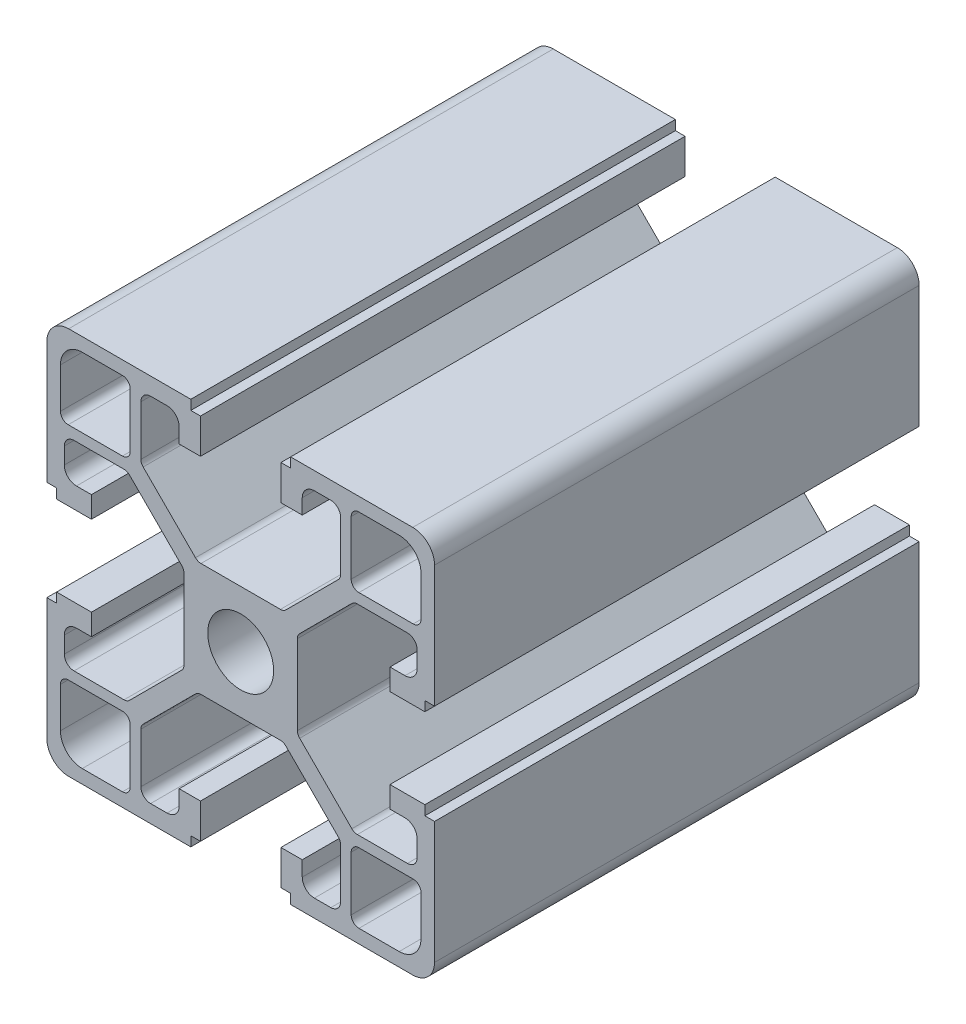
from build123d import *

# Parameters (mm, degrees)
SKETCH1_R           = 3.4
BOSS_EXTRUDE1_DEPTH = 713
SKETCH2_W           = 40
SKETCH2_H           = 113
CUT_EXTRUDE1_DEPTH  = 715.401147815
SKETCH3_W           = 40
SKETCH3_H           = 550
CUT_EXTRUDE2_DEPTH  = 602.66435826


with BuildPart() as part:
    # Sketch1 → Boss-Extrude1 (new body)
    with BuildSketch(Plane.XY):
        with BuildLine():
            Line((20, 17.75), (20, 5.15))
            Line((20, 5.15), (19, 5.15))
            Line((19, 5.15), (19, 4.15))
            Line((19, 4.15), (15.4, 4.15))
            Line((15.4, 4.15), (15.4, 6.35))
            Line((15.4, 6.35), (16.95, 6.35))
            ThreePointArc((16.95, 6.35), (17.833883476, 6.716116524), (18.2, 7.6))
            Line((18.2, 7.6), (18.2, 9.3))
            ThreePointArc((18.2, 9.3), (17.907106781, 10.007106781), (17.2, 10.3))
            Line((17.2, 10.3), (12.03669957, 10.3))
            ThreePointArc((12.03669957, 10.3), (11.73040037, 10.239040459), (11.470780817, 10.065452001))
            Line((11.470780817, 10.065452001), (6.084081247, 4.674305984))
            ThreePointArc((6.084081247, 4.674305984), (5.910833239, 4.414848262), (5.85, 4.108853983))
            Line((5.85, 4.108853983), (5.85, -4.108853983))
            ThreePointArc((5.85, -4.108853983), (5.910833239, -4.414848262), (6.084081247, -4.674305984))
            Line((6.084081247, -4.674305984), (11.470780817, -10.065452001))
            ThreePointArc((11.470780817, -10.065452001), (11.73040037, -10.239040459), (12.03669957, -10.3))
            Line((12.03669957, -10.3), (17.2, -10.3))
            ThreePointArc((17.2, -10.3), (17.907106781, -10.007106781), (18.2, -9.3))
            Line((18.2, -9.3), (18.2, -7.6))
            ThreePointArc((18.2, -7.6), (17.833883476, -6.716116524), (16.95, -6.35))
            Line((16.95, -6.35), (15.4, -6.35))
            Line((15.4, -6.35), (15.4, -4.15))
            Line((15.4, -4.15), (19, -4.15))
            Line((19, -4.15), (19, -5.15))
            Line((19, -5.15), (20, -5.15))
            Line((20, -5.15), (20, -17.75))
            ThreePointArc((20, -17.75), (19.340990258, -19.340990258), (17.75, -20))
            Line((17.75, -20), (5.15, -20))
            Line((5.15, -20), (5.15, -19))
            Line((5.15, -19), (4.15, -19))
            Line((4.15, -19), (4.15, -15.4))
            Line((4.15, -15.4), (6.35, -15.4))
            Line((6.35, -15.4), (6.35, -16.95))
            ThreePointArc((6.35, -16.95), (6.716116524, -17.833883476), (7.6, -18.2))
            Line((7.6, -18.2), (9.3, -18.2))
            ThreePointArc((9.3, -18.2), (10.007106781, -17.907106781), (10.3, -17.2))
            Line((10.3, -17.2), (10.3, -12.054477022))
            ThreePointArc((10.3, -12.054477022), (10.239166761, -11.748482743), (10.065918753, -11.489025021))
            Line((10.065918753, -11.489025021), (4.665899173, -6.084547999))
            ThreePointArc((4.665899173, -6.084547999), (4.406279619, -5.910959541), (4.09998042, -5.85))
            Line((4.09998042, -5.85), (-4.09998042, -5.85))
            ThreePointArc((-4.09998042, -5.85), (-4.406279619, -5.910959541), (-4.665899173, -6.084547999))
            Line((-4.665899173, -6.084547999), (-10.065918753, -11.489025021))
            ThreePointArc((-10.065918753, -11.489025021), (-10.239166761, -11.748482743), (-10.3, -12.054477022))
            Line((-10.3, -12.054477022), (-10.3, -17.2))
            ThreePointArc((-10.3, -17.2), (-10.007106781, -17.907106781), (-9.3, -18.2))
            Line((-9.3, -18.2), (-7.6, -18.2))
            ThreePointArc((-7.6, -18.2), (-6.716116524, -17.833883476), (-6.35, -16.95))
            Line((-6.35, -16.95), (-6.35, -15.4))
            Line((-6.35, -15.4), (-4.15, -15.4))
            Line((-4.15, -15.4), (-4.15, -19))
            Line((-4.15, -19), (-5.15, -19))
            Line((-5.15, -19), (-5.15, -20))
            Line((-5.15, -20), (-17.75, -20))
            ThreePointArc((-17.75, -20), (-19.340990258, -19.340990258), (-20, -17.75))
            Line((-20, -17.75), (-20, -5.15))
            Line((-20, -5.15), (-19, -5.15))
            Line((-19, -5.15), (-19, -4.15))
            Line((-19, -4.15), (-15.4, -4.15))
            Line((-15.4, -4.15), (-15.4, -6.35))
            Line((-15.4, -6.35), (-16.95, -6.35))
            ThreePointArc((-16.95, -6.35), (-17.833883476, -6.716116524), (-18.2, -7.6))
            Line((-18.2, -7.6), (-18.2, -9.3))
            ThreePointArc((-18.2, -9.3), (-17.907106781, -10.007106781), (-17.2, -10.3))
            Line((-17.2, -10.3), (-12.03669957, -10.3))
            ThreePointArc((-12.03669957, -10.3), (-11.73040037, -10.239040459), (-11.470780817, -10.065452001))
            Line((-11.470780817, -10.065452001), (-6.084081247, -4.674305984))
            ThreePointArc((-6.084081247, -4.674305984), (-5.910833239, -4.414848262), (-5.85, -4.108853983))
            Line((-5.85, -4.108853983), (-5.85, 4.108853983))
            ThreePointArc((-5.85, 4.108853983), (-5.910833239, 4.414848262), (-6.084081247, 4.674305984))
            Line((-6.084081247, 4.674305984), (-11.470780817, 10.065452001))
            ThreePointArc((-11.470780817, 10.065452001), (-11.73040037, 10.239040459), (-12.03669957, 10.3))
            Line((-12.03669957, 10.3), (-17.2, 10.3))
            ThreePointArc((-17.2, 10.3), (-17.907106781, 10.007106781), (-18.2, 9.3))
            Line((-18.2, 9.3), (-18.2, 7.6))
            ThreePointArc((-18.2, 7.6), (-17.833883476, 6.716116524), (-16.95, 6.35))
            Line((-16.95, 6.35), (-15.4, 6.35))
            Line((-15.4, 6.35), (-15.4, 4.15))
            Line((-15.4, 4.15), (-19, 4.15))
            Line((-19, 4.15), (-19, 5.15))
            Line((-19, 5.15), (-20, 5.15))
            Line((-20, 5.15), (-20, 17.75))
            ThreePointArc((-20, 17.75), (-19.340990258, 19.340990258), (-17.75, 20))
            Line((-17.75, 20), (-5.15, 20))
            Line((-5.15, 20), (-5.15, 19))
            Line((-5.15, 19), (-4.15, 19))
            Line((-4.15, 19), (-4.15, 15.4))
            Line((-4.15, 15.4), (-6.35, 15.4))
            Line((-6.35, 15.4), (-6.35, 16.95))
            ThreePointArc((-6.35, 16.95), (-6.716116524, 17.833883476), (-7.6, 18.2))
            Line((-7.6, 18.2), (-9.3, 18.2))
            ThreePointArc((-9.3, 18.2), (-10.007106781, 17.907106781), (-10.3, 17.2))
            Line((-10.3, 17.2), (-10.3, 12.054477022))
            ThreePointArc((-10.3, 12.054477022), (-10.239166761, 11.748482743), (-10.065918753, 11.489025021))
            Line((-10.065918753, 11.489025021), (-4.665899173, 6.084547999))
            ThreePointArc((-4.665899173, 6.084547999), (-4.406279619, 5.910959541), (-4.09998042, 5.85))
            Line((-4.09998042, 5.85), (4.09998042, 5.85))
            ThreePointArc((4.09998042, 5.85), (4.406279619, 5.910959541), (4.665899173, 6.084547999))
            Line((4.665899173, 6.084547999), (10.065918753, 11.489025021))
            ThreePointArc((10.065918753, 11.489025021), (10.239166761, 11.748482743), (10.3, 12.054477022))
            Line((10.3, 12.054477022), (10.3, 17.2))
            ThreePointArc((10.3, 17.2), (10.007106781, 17.907106781), (9.3, 18.2))
            Line((9.3, 18.2), (7.6, 18.2))
            ThreePointArc((7.6, 18.2), (6.716116524, 17.833883476), (6.35, 16.95))
            Line((6.35, 16.95), (6.35, 15.4))
            Line((6.35, 15.4), (4.15, 15.4))
            Line((4.15, 15.4), (4.15, 19))
            Line((4.15, 19), (5.15, 19))
            Line((5.15, 19), (5.15, 20))
            Line((5.15, 20), (17.75, 20))
            ThreePointArc((17.75, 20), (19.340990258, 19.340990258), (20, 17.75))
        make_face()
        with Locations(Location((0, 0, 0), (0, 0, 180))):
            Circle(SKETCH1_R, mode=Mode.SUBTRACT)
        with BuildLine():
            Line((18.6, 16.35), (18.6, 12.2))
            ThreePointArc((18.6, 12.2), (18.365685425, 11.634314575), (17.8, 11.4))
            Line((17.8, 11.4), (12.2, 11.4))
            ThreePointArc((12.2, 11.4), (11.634314575, 11.634314575), (11.4, 12.2))
            Line((11.4, 12.2), (11.4, 17.8))
            ThreePointArc((11.4, 17.8), (11.634314575, 18.365685425), (12.2, 18.6))
            Line((12.2, 18.6), (16.35, 18.6))
            ThreePointArc((16.35, 18.6), (17.940990258, 17.940990258), (18.6, 16.35))
        make_face(mode=Mode.SUBTRACT)
        with BuildLine():
            Line((-12.2, 18.6), (-16.35, 18.6))
            ThreePointArc((-16.35, 18.6), (-17.940990258, 17.940990258), (-18.6, 16.35))
            Line((-18.6, 16.35), (-18.6, 12.2))
            ThreePointArc((-18.6, 12.2), (-18.365685425, 11.634314575), (-17.8, 11.4))
            Line((-17.8, 11.4), (-12.2, 11.4))
            ThreePointArc((-12.2, 11.4), (-11.634314575, 11.634314575), (-11.4, 12.2))
            Line((-11.4, 12.2), (-11.4, 17.8))
            ThreePointArc((-11.4, 17.8), (-11.634314575, 18.365685425), (-12.2, 18.6))
        make_face(mode=Mode.SUBTRACT)
        with BuildLine():
            Line((-18.6, -16.35), (-18.6, -12.2))
            ThreePointArc((-18.6, -12.2), (-18.365685425, -11.634314575), (-17.8, -11.4))
            Line((-17.8, -11.4), (-12.2, -11.4))
            ThreePointArc((-12.2, -11.4), (-11.634314575, -11.634314575), (-11.4, -12.2))
            Line((-11.4, -12.2), (-11.4, -17.8))
            ThreePointArc((-11.4, -17.8), (-11.634314575, -18.365685425), (-12.2, -18.6))
            Line((-12.2, -18.6), (-16.35, -18.6))
            ThreePointArc((-16.35, -18.6), (-17.940990258, -17.940990258), (-18.6, -16.35))
        make_face(mode=Mode.SUBTRACT)
        with BuildLine():
            Line((12.2, -18.6), (16.35, -18.6))
            ThreePointArc((16.35, -18.6), (17.940990258, -17.940990258), (18.6, -16.35))
            Line((18.6, -16.35), (18.6, -12.2))
            ThreePointArc((18.6, -12.2), (18.365685425, -11.634314575), (17.8, -11.4))
            Line((17.8, -11.4), (12.2, -11.4))
            ThreePointArc((12.2, -11.4), (11.634314575, -11.634314575), (11.4, -12.2))
            Line((11.4, -12.2), (11.4, -17.8))
            ThreePointArc((11.4, -17.8), (11.634314575, -18.365685425), (12.2, -18.6))
        make_face(mode=Mode.SUBTRACT)
    extrude(amount=BOSS_EXTRUDE1_DEPTH)

    # Sketch2 → Cut-Extrude1 (cut, through all)
    with BuildSketch(Plane(origin=(0, 20, 0), x_dir=(1, 0, 0), z_dir=(0, 1, 0))):
        with Locations((0, -656.5)):
            Rectangle(SKETCH2_W, SKETCH2_H)
    extrude(amount=-CUT_EXTRUDE1_DEPTH, mode=Mode.SUBTRACT)

    # Sketch3 → Cut-Extrude2 (cut, through all)
    with BuildSketch(Plane(origin=(0, 20, 0), x_dir=(1, 0, 0), z_dir=(0, 1, 0))):
        with Locations((0, -325)):
            Rectangle(SKETCH3_W, SKETCH3_H)
    extrude(amount=-CUT_EXTRUDE2_DEPTH, mode=Mode.SUBTRACT)


solid = part.part
